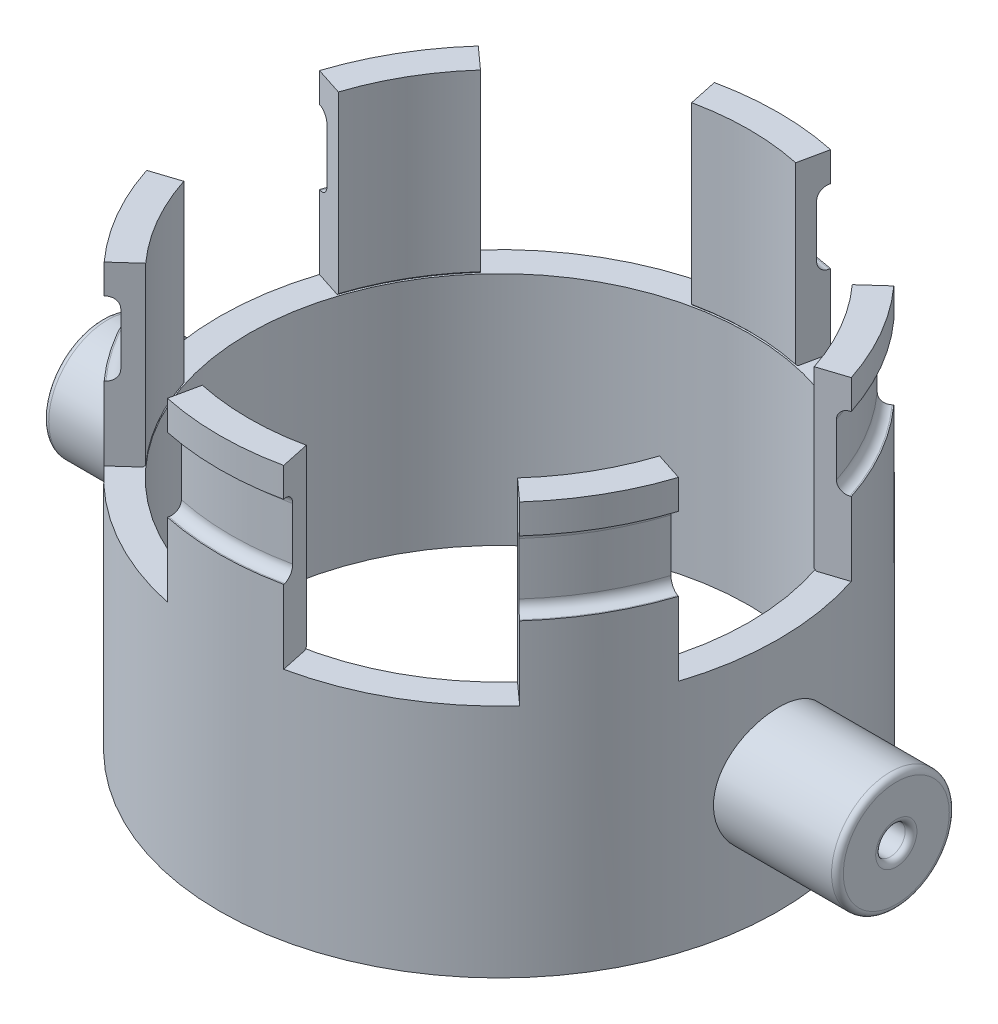
from build123d import *
from build123d.topology import SkipClean

# Parameters (mm, degrees)
SKETCH1_R           = 60.325
SKETCH1_R_2         = 53.975
BOSS_EXTRUDE1_DEPTH = 50.8
BOSS_EXTRUDE2_START = -1.351993
SKETCH2_R           = 12.7
BOSS_EXTRUDE2_DEPTH = 26.751993
SKETCH3_R           = 3.175
CUT_EXTRUDE1_DEPTH  = 50.8
FILLET1_R           = 1.27
BOSS_EXTRUDE3_DEPTH = 38.1
CUT_EXTRUDE4_START  = -6.35
SKETCH9_R           = 6.35
CUT_EXTRUDE4_DEPTH  = 13.97


with BuildPart() as part:
    # Sketch1 → Boss-Extrude1 (new body)
    with BuildSketch(Plane(origin=(0, 0, 0), x_dir=(1, 0, 0), z_dir=(0, 1, 0))):
        with Locations(Location((0, 0, 0), (0, 0, 270))):
            Circle(SKETCH1_R)
        with Locations(Location((0, 0, 0), (0, 0, 270))):
            Circle(SKETCH1_R_2, mode=Mode.SUBTRACT)
    extrude(amount=BOSS_EXTRUDE1_DEPTH)

    # Sketch2 → Boss-Extrude2 (add)
    with BuildSketch(Plane.ZY.offset(60.325).offset(BOSS_EXTRUDE2_START)):
        with Locations(Location((0, 25.4, 0), (0, 0, 180))):
            Circle(SKETCH2_R)
    boss_extrude2 = extrude(amount=BOSS_EXTRUDE2_DEPTH)

    # Sketch3 → Cut-Extrude1 (cut)
    with BuildSketch(Plane.ZY.offset(85.725)):
        with Locations((0, 25.4)):
            Circle(SKETCH3_R)
    cut_extrude1 = extrude(amount=-CUT_EXTRUDE1_DEPTH, mode=Mode.SUBTRACT)

    # Mirror1: Boss-Extrude2, Cut-Extrude1 across plane
    add(boss_extrude2.mirror(Plane(origin=(0, 0, 0), x_dir=(0, 0, 1), z_dir=(1, 0, 0))))
    add(cut_extrude1.mirror(Plane(origin=(0, 0, 0), x_dir=(0, 0, 1), z_dir=(1, 0, 0))), mode=Mode.SUBTRACT)

    # Fillet1
    fillet1_edges = [part.edges().sort_by_distance(p)[0] for p in [
        (-85.725, 25.4, 12.7),
        (-85.725, 25.4, -3.175),
        (85.725, 25.4, 12.7),
        (85.725, 25.4, -3.175),
    ]]
    fillet(fillet1_edges, radius=FILLET1_R)

    # Sketch5 → Boss-Extrude3 (add)
    with SkipClean():  # the faces are left unmerged after this step: merging them gives an invalid solid
        with BuildSketch(Plane(origin=(0, 50.8, 0), x_dir=(1, 0, 0), z_dir=(0, 1, 0))):
            with BuildLine():
                Line((12.542272749, 59.006754014), (11.222033512, 52.79551675))
                ThreePointArc((11.222033512, 52.79551675), (0, 53.975), (-11.222033512, 52.79551675))
                Line((-11.222033512, 52.79551675), (-12.542272749, 59.006754014))
                ThreePointArc((-12.542272749, 59.006754014), (-6.305679547, 59.994533338), (0, 60.325))
                ThreePointArc((0, 60.325), (6.305679547, 59.994533338), (12.542272749, 59.006754014))
            make_face()
            with BuildLine():
                Line((44.830211597, 40.365303829), (40.111241955, 36.116324478))
                ThreePointArc((40.111241955, 36.116324478), (46.743721169, 26.9875), (51.333275467, 16.679192271))
                Line((51.333275467, 16.679192271), (57.372484346, 18.641450186))
                ThreePointArc((57.372484346, 18.641450186), (55.109629732, 24.536387994), (52.242982483, 30.1625))
                ThreePointArc((52.242982483, 30.1625), (48.803950186, 35.458145345), (44.830211597, 40.365303829))
            make_face()
            with BuildLine():
                Line((57.372484346, -18.641450186), (51.333275467, -16.679192271))
                ThreePointArc((51.333275467, -16.679192271), (46.743721169, -26.9875), (40.111241955, -36.116324478))
                Line((40.111241955, -36.116324478), (44.830211597, -40.365303829))
                ThreePointArc((44.830211597, -40.365303829), (48.803950186, -35.458145345), (52.242982483, -30.1625))
                ThreePointArc((52.242982483, -30.1625), (55.109629732, -24.536387994), (57.372484346, -18.641450186))
            make_face()
            with BuildLine():
                Line((12.542272749, -59.006754014), (11.222033512, -52.79551675))
                ThreePointArc((11.222033512, -52.79551675), (0, -53.975), (-11.222033512, -52.79551675))
                Line((-11.222033512, -52.79551675), (-12.542272749, -59.006754014))
                ThreePointArc((-12.542272749, -59.006754014), (-6.305679547, -59.994533338), (0, -60.325))
                ThreePointArc((0, -60.325), (6.305679547, -59.994533338), (12.542272749, -59.006754014))
            make_face()
            with BuildLine():
                Line((-44.830211597, -40.365303829), (-40.111241955, -36.116324478))
                ThreePointArc((-40.111241955, -36.116324478), (-46.743721169, -26.9875), (-51.333275467, -16.679192271))
                Line((-51.333275467, -16.679192271), (-57.372484346, -18.641450186))
                ThreePointArc((-57.372484346, -18.641450186), (-55.109629732, -24.536387994), (-52.242982483, -30.1625))
                ThreePointArc((-52.242982483, -30.1625), (-48.803950186, -35.458145345), (-44.830211597, -40.365303829))
            make_face()
            with BuildLine():
                Line((-57.372484346, 18.641450186), (-51.333275467, 16.679192271))
                ThreePointArc((-51.333275467, 16.679192271), (-46.743721169, 26.9875), (-40.111241955, 36.116324478))
                Line((-40.111241955, 36.116324478), (-44.830211597, 40.365303829))
                ThreePointArc((-44.830211597, 40.365303829), (-48.803950186, 35.458145345), (-52.242982483, 30.1625))
                ThreePointArc((-52.242982483, 30.1625), (-55.109629732, 24.536387994), (-57.372484346, 18.641450186))
            make_face()
        extrude(amount=BOSS_EXTRUDE3_DEPTH)

    # Sketch6 → Cut-Revolve1 (revolve, cut)
    with BuildSketch(Plane(origin=(0, 0, 0), x_dir=(0, 0, -1), z_dir=(1, 0, 0)), mode=Mode.PRIVATE) as cut_revolve1_sk:
        with BuildLine():
            Line((-52.79551675, 50.8), (-54.38301675, 50.8))
            ThreePointArc((-54.38301675, 50.8), (-53.282853464, 52.234293357), (-52.79551675, 53.975))
            Line((-52.79551675, 53.975), (-52.79551675, 50.8))
        make_face()
    revolve(cut_revolve1_sk.sketch.rotate(Axis((0, 50.8, 0), (0, -1, 0)), 168), axis=Axis((0, 50.8, 0), (0, -1, 0)), mode=Mode.SUBTRACT)

    # Sketch8 → Cut-Revolve3 (revolve, cut)
    with BuildSketch(Plane(origin=(0, 0, 0), x_dir=(0.9510565162951539, 0, 0.30901699437494684), z_dir=(-0.30901699437494684, 0, 0.9510565162951539)), mode=Mode.PRIVATE) as cut_revolve3_sk:
        with BuildLine():
            Line((-60.325, 82.55), (-60.071, 82.55))
            ThreePointArc((-60.071, 82.55), (-58.454553898, 81.880446102), (-57.785, 80.264))
            Line((-57.785, 80.264), (-57.785, 68.961))
            ThreePointArc((-57.785, 68.961), (-58.454553898, 67.344553898), (-60.071, 66.675))
            Line((-60.071, 66.675), (-60.325, 66.675))
            Line((-60.325, 66.675), (-60.325, 82.55))
        make_face()
    revolve(cut_revolve3_sk.sketch.rotate(Axis((0, 50.8, 0), (0, -1, 0)), 60), axis=Axis((0, 50.8, 0), (0, -1, 0)), mode=Mode.SUBTRACT)

    # Sketch9 → Cut-Extrude4 (cut)
    with BuildSketch(Plane(origin=(-53.975, 0, 0), x_dir=(0, 0, -1), z_dir=(1, 0, 0)).offset(CUT_EXTRUDE4_START)):
        with Locations(Location((0, 25.4, 0), (0, 0, 180))):
            Circle(SKETCH9_R)
    cut_extrude4 = extrude(amount=CUT_EXTRUDE4_DEPTH, mode=Mode.SUBTRACT)

    # Mirror2: Cut-Extrude4 across plane
    add(cut_extrude4.mirror(Plane(origin=(0, 0, 0), x_dir=(0, 0, 1), z_dir=(1, 0, 0))), mode=Mode.SUBTRACT)


solid = part.part
